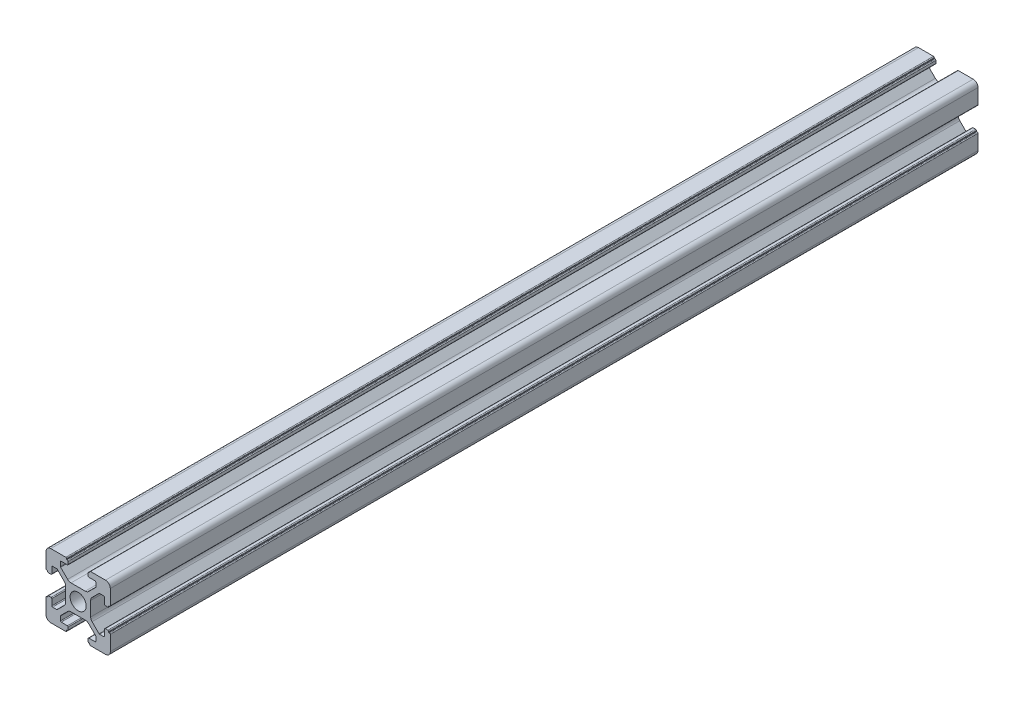
from build123d import *

# Parameters (mm, degrees)
SKETCH_1_R      = 2.5
EXTRUDE_1_DEPTH = 270


with BuildPart() as part:
    # 草图1 → 凸台-拉伸1 (new body)
    with BuildSketch(Plane.XY):
        with BuildLine():
            Line((-8.502261885, -10.002261885), (-3.85, -10.002261885))
            ThreePointArc((-3.85, -10.002261885), (-3.673223305, -9.929038581), (-3.6, -9.752261885))
            Line((-3.6, -9.752261885), (-3.6, -9.502261885))
            Line((-3.6, -9.502261885), (-3.35, -9.502261885))
            ThreePointArc((-3.35, -9.502261885), (-3.173223305, -9.429038581), (-3.1, -9.252261885))
            Line((-3.1, -9.252261885), (-3.1, -8.45))
            ThreePointArc((-3.1, -8.45), (-3.173223305, -8.273223305), (-3.35, -8.2))
            Line((-3.35, -8.2), (-5.25, -8.2))
            ThreePointArc((-5.25, -8.2), (-5.426776695, -8.126776695), (-5.5, -7.95))
            Line((-5.5, -7.95), (-5.5, -6.664213562))
            ThreePointArc((-5.5, -6.664213562), (-5.480969883, -6.568542704), (-5.426776695, -6.487436867))
            Line((-5.426776695, -6.487436867), (-3.278679656, -4.339339828))
            ThreePointArc((-3.278679656, -4.339339828), (-2.792044633, -4.014180701), (-2.218019485, -3.9))
            Line((-2.218019485, -3.9), (2.218019485, -3.9))
            ThreePointArc((2.218019485, -3.9), (2.792044633, -4.014180701), (3.278679656, -4.339339828))
            Line((3.278679656, -4.339339828), (5.426776695, -6.487436867))
            ThreePointArc((5.426776695, -6.487436867), (5.480969883, -6.568542704), (5.5, -6.664213562))
            Line((5.5, -6.664213562), (5.5, -7.95))
            ThreePointArc((5.5, -7.95), (5.426776695, -8.126776695), (5.25, -8.2))
            Line((5.25, -8.2), (3.35, -8.2))
            ThreePointArc((3.35, -8.2), (3.173223305, -8.273223305), (3.1, -8.45))
            Line((3.1, -8.45), (3.1, -9.252261885))
            ThreePointArc((3.1, -9.252261885), (3.173223305, -9.429038581), (3.35, -9.502261885))
            Line((3.35, -9.502261885), (3.6, -9.502261885))
            Line((3.6, -9.502261885), (3.6, -9.752261885))
            ThreePointArc((3.6, -9.752261885), (3.673223305, -9.929038581), (3.85, -10.002261885))
            Line((3.85, -10.002261885), (8.502261885, -10.002261885))
            ThreePointArc((8.502261885, -10.002261885), (9.562922057, -9.562922057), (10.002261885, -8.502261885))
            Line((10.002261885, -8.502261885), (10.002261885, -3.85))
            ThreePointArc((10.002261885, -3.85), (9.929038581, -3.673223305), (9.752261885, -3.6))
            Line((9.752261885, -3.6), (9.502261885, -3.6))
            Line((9.502261885, -3.6), (9.502261885, -3.35))
            ThreePointArc((9.502261885, -3.35), (9.429038581, -3.173223305), (9.252261885, -3.1))
            Line((9.252261885, -3.1), (8.45, -3.1))
            ThreePointArc((8.45, -3.1), (8.273223305, -3.173223305), (8.2, -3.35))
            Line((8.2, -3.35), (8.2, -5.25))
            ThreePointArc((8.2, -5.25), (8.126776695, -5.426776695), (7.95, -5.5))
            Line((7.95, -5.5), (6.664213562, -5.5))
            ThreePointArc((6.664213562, -5.5), (6.568542704, -5.480969883), (6.487436867, -5.426776695))
            Line((6.487436867, -5.426776695), (4.339339828, -3.278679656))
            ThreePointArc((4.339339828, -3.278679656), (4.014180701, -2.792044633), (3.9, -2.218019485))
            Line((3.9, -2.218019485), (3.9, 2.218019485))
            ThreePointArc((3.9, 2.218019485), (4.014180701, 2.792044633), (4.339339828, 3.278679656))
            Line((4.339339828, 3.278679656), (6.487436867, 5.426776695))
            ThreePointArc((6.487436867, 5.426776695), (6.568542704, 5.480969883), (6.664213562, 5.5))
            Line((6.664213562, 5.5), (7.95, 5.5))
            ThreePointArc((7.95, 5.5), (8.126776695, 5.426776695), (8.2, 5.25))
            Line((8.2, 5.25), (8.2, 3.35))
            ThreePointArc((8.2, 3.35), (8.273223305, 3.173223305), (8.45, 3.1))
            Line((8.45, 3.1), (9.252261885, 3.1))
            ThreePointArc((9.252261885, 3.1), (9.429038581, 3.173223305), (9.502261885, 3.35))
            Line((9.502261885, 3.35), (9.502261885, 3.6))
            Line((9.502261885, 3.6), (9.752261885, 3.6))
            ThreePointArc((9.752261885, 3.6), (9.929038581, 3.673223305), (10.002261885, 3.85))
            Line((10.002261885, 3.85), (10.002261885, 8.502261885))
            ThreePointArc((10.002261885, 8.502261885), (9.562922057, 9.562922057), (8.502261885, 10.002261885))
            Line((8.502261885, 10.002261885), (3.85, 10.002261885))
            ThreePointArc((3.85, 10.002261885), (3.673223305, 9.929038581), (3.6, 9.752261885))
            Line((3.6, 9.752261885), (3.6, 9.502261885))
            Line((3.6, 9.502261885), (3.35, 9.502261885))
            ThreePointArc((3.35, 9.502261885), (3.173223305, 9.429038581), (3.1, 9.252261885))
            Line((3.1, 9.252261885), (3.1, 8.45))
            ThreePointArc((3.1, 8.45), (3.173223305, 8.273223305), (3.35, 8.2))
            Line((3.35, 8.2), (5.25, 8.2))
            ThreePointArc((5.25, 8.2), (5.426776695, 8.126776695), (5.5, 7.95))
            Line((5.5, 7.95), (5.5, 6.664213562))
            ThreePointArc((5.5, 6.664213562), (5.480969883, 6.568542704), (5.426776695, 6.487436867))
            Line((5.426776695, 6.487436867), (3.278679656, 4.339339828))
            ThreePointArc((3.278679656, 4.339339828), (2.792044633, 4.014180701), (2.218019485, 3.9))
            Line((2.218019485, 3.9), (-2.218019485, 3.9))
            ThreePointArc((-2.218019485, 3.9), (-2.792044633, 4.014180701), (-3.278679656, 4.339339828))
            Line((-3.278679656, 4.339339828), (-5.426776695, 6.487436867))
            ThreePointArc((-5.426776695, 6.487436867), (-5.480969883, 6.568542704), (-5.5, 6.664213562))
            Line((-5.5, 6.664213562), (-5.5, 7.95))
            ThreePointArc((-5.5, 7.95), (-5.426776695, 8.126776695), (-5.25, 8.2))
            Line((-5.25, 8.2), (-3.35, 8.2))
            ThreePointArc((-3.35, 8.2), (-3.173223305, 8.273223305), (-3.1, 8.45))
            Line((-3.1, 8.45), (-3.1, 9.252261885))
            ThreePointArc((-3.1, 9.252261885), (-3.173223305, 9.429038581), (-3.35, 9.502261885))
            Line((-3.35, 9.502261885), (-3.6, 9.502261885))
            Line((-3.6, 9.502261885), (-3.6, 9.752261885))
            ThreePointArc((-3.6, 9.752261885), (-3.673223305, 9.929038581), (-3.85, 10.002261885))
            Line((-3.85, 10.002261885), (-8.502261885, 10.002261885))
            ThreePointArc((-8.502261885, 10.002261885), (-9.562922057, 9.562922057), (-10.002261885, 8.502261885))
            Line((-10.002261885, 8.502261885), (-10.002261885, 3.85))
            ThreePointArc((-10.002261885, 3.85), (-9.929038581, 3.673223305), (-9.752261885, 3.6))
            Line((-9.752261885, 3.6), (-9.502261885, 3.6))
            Line((-9.502261885, 3.6), (-9.502261885, 3.35))
            ThreePointArc((-9.502261885, 3.35), (-9.429038581, 3.173223305), (-9.252261885, 3.1))
            Line((-9.252261885, 3.1), (-8.45, 3.1))
            ThreePointArc((-8.45, 3.1), (-8.273223305, 3.173223305), (-8.2, 3.35))
            Line((-8.2, 3.35), (-8.2, 5.25))
            ThreePointArc((-8.2, 5.25), (-8.126776695, 5.426776695), (-7.95, 5.5))
            Line((-7.95, 5.5), (-6.664213562, 5.5))
            ThreePointArc((-6.664213562, 5.5), (-6.568542704, 5.480969883), (-6.487436867, 5.426776695))
            Line((-6.487436867, 5.426776695), (-4.339339828, 3.278679656))
            ThreePointArc((-4.339339828, 3.278679656), (-4.014180701, 2.792044633), (-3.9, 2.218019485))
            Line((-3.9, 2.218019485), (-3.9, -2.218019485))
            ThreePointArc((-3.9, -2.218019485), (-4.014180701, -2.792044633), (-4.339339828, -3.278679656))
            Line((-4.339339828, -3.278679656), (-6.487436867, -5.426776695))
            ThreePointArc((-6.487436867, -5.426776695), (-6.568542704, -5.480969883), (-6.664213562, -5.5))
            Line((-6.664213562, -5.5), (-7.95, -5.5))
            ThreePointArc((-7.95, -5.5), (-8.126776695, -5.426776695), (-8.2, -5.25))
            Line((-8.2, -5.25), (-8.2, -3.35))
            ThreePointArc((-8.2, -3.35), (-8.273223305, -3.173223305), (-8.45, -3.1))
            Line((-8.45, -3.1), (-9.252261885, -3.1))
            ThreePointArc((-9.252261885, -3.1), (-9.429038581, -3.173223305), (-9.502261885, -3.35))
            Line((-9.502261885, -3.35), (-9.502261885, -3.6))
            Line((-9.502261885, -3.6), (-9.752261885, -3.6))
            ThreePointArc((-9.752261885, -3.6), (-9.929038581, -3.673223305), (-10.002261885, -3.85))
            Line((-10.002261885, -3.85), (-10.002261885, -8.502261885))
            ThreePointArc((-10.002261885, -8.502261885), (-9.562922057, -9.562922057), (-8.502261885, -10.002261885))
        make_face()
        Circle(SKETCH_1_R, mode=Mode.SUBTRACT)
    extrude(amount=EXTRUDE_1_DEPTH)


solid = part.part
